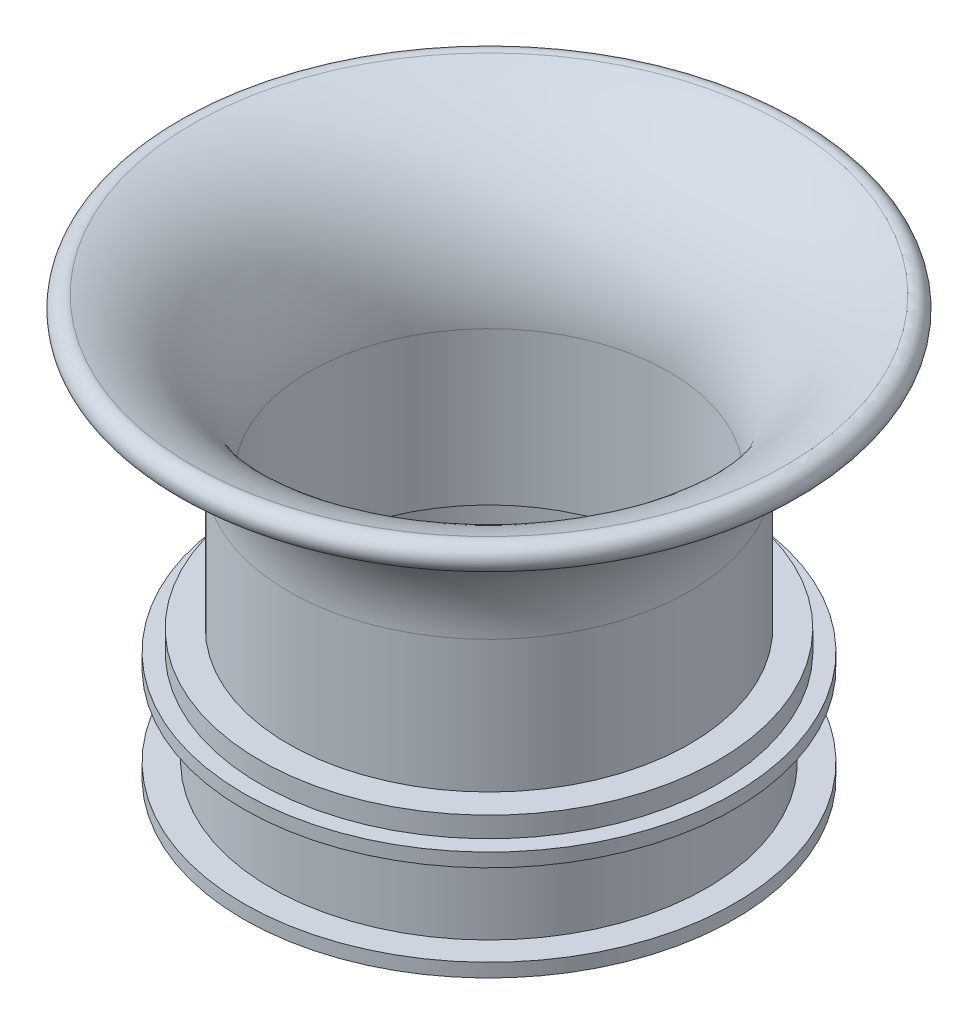
from build123d import *


with BuildPart() as part:
    # Sketch2 → Revolve1 (revolve)
    with BuildSketch(Plane.XY, mode=Mode.PRIVATE) as revolve1_sk:
        with BuildLine():
            Line((20.955, 30.48), (20.955, 12.7))
            Line((20.955, 12.7), (22.225, 12.7))
            Line((22.225, 12.7), (22.225, 0))
            Line((22.225, 0), (28.575, 0))
            Line((28.575, 0), (28.575, 1.5875))
            Line((28.575, 1.5875), (25.4, 1.5875))
            Line((25.4, 1.5875), (25.4, 11.1125))
            Line((25.4, 11.1125), (28.575, 11.1125))
            Line((28.575, 11.1125), (28.575, 12.7))
            Line((28.575, 12.7), (26.67, 12.7))
            Line((26.67, 12.7), (26.67, 15.079229731))
            Line((26.67, 15.079229731), (23.368, 15.079229731))
            Line((23.368, 15.079229731), (23.368, 30.48))
            ThreePointArc((23.368, 30.48), (26.699072346, 40.209619932), (35.294362711, 45.856081704))
            ThreePointArc((35.294362711, 45.856081704), (36.355227336, 47.693893747), (34.495528336, 48.715904748))
            ThreePointArc((34.495528336, 48.715904748), (24.710263402, 41.836651461), (20.955, 30.48))
        make_face()
    revolve(revolve1_sk.sketch.rotate(Axis((0, 0, 0), (0, 1, 0)), 90), axis=Axis((0, 0, 0), (0, 1, 0)))


solid = part.part
